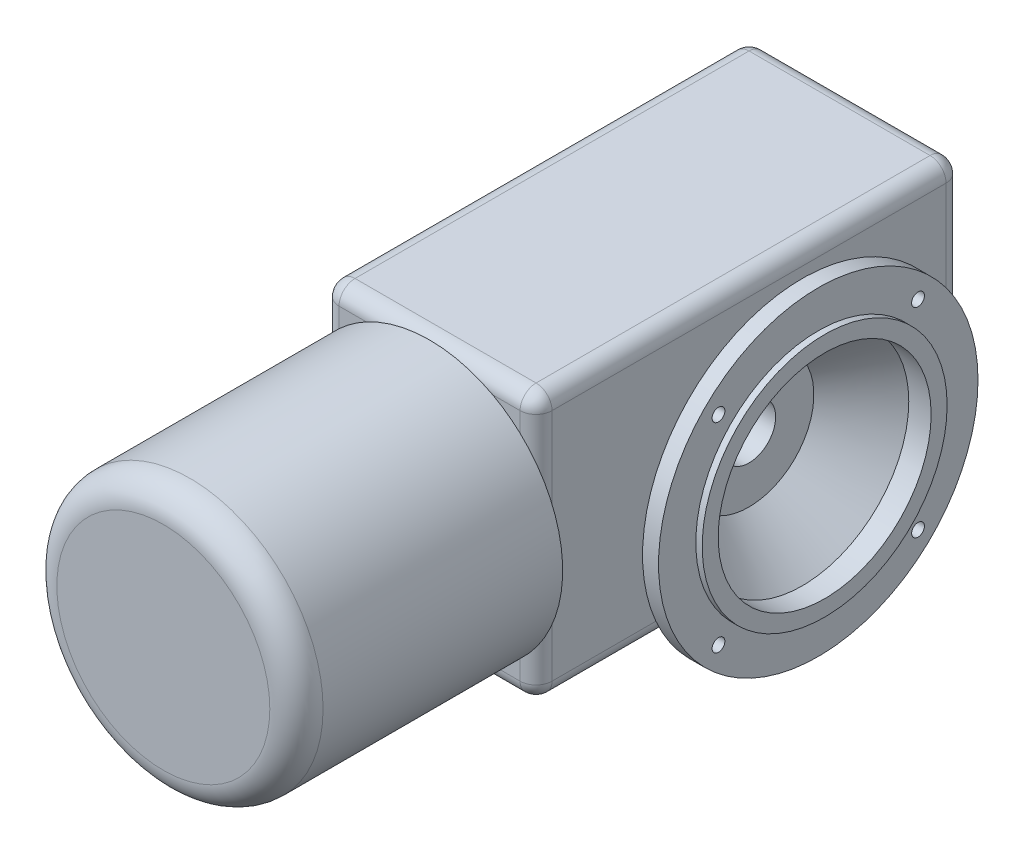
from build123d import *

# Parameters (mm, degrees)
SKETCH_4_W          = 400
SKETCH_4_H          = 250
EXTRUDE_4_DEPTH     = 200
SKETCH_10_R         = 25
CUT_EXTRUDE_1_DEPTH = 180
FILLET_3_R          = 15
SKETCH_9_R          = 125
EXTRUDE_8_DEPTH     = 250
FILLET_4_R          = 25
SKETCH_5_R          = 150
SKETCH_5_R_2        = 100
EXTRUDE_5_DEPTH     = 15
SKETCH_6_R          = 115
SKETCH_6_R_2        = 100
EXTRUDE_6_DEPTH     = 6
SKETCH_13_R         = 6
CUT_EXTRUDE_2_DEPTH = 15


with BuildPart() as part:
    # 草图4 → 凸台-拉伸4 (new body)
    with BuildSketch(Plane(origin=(0, 0, 0), x_dir=(0, 0, -1), z_dir=(1, 0, 0))):
        Rectangle(SKETCH_4_W, SKETCH_4_H)
    extrude(amount=-EXTRUDE_4_DEPTH)

    # 草图10 → 切除-拉伸1 (cut)
    with BuildSketch(Plane(origin=(0, 0, 0), x_dir=(0, 0, -1), z_dir=(1, 0, 0))):
        Circle(SKETCH_10_R)
    extrude(amount=-CUT_EXTRUDE_1_DEPTH, mode=Mode.SUBTRACT)

    # 圆角3
    fillet_3_edges = [part.edges().sort_by_distance(p)[0] for p in [
        (-200, 0, -200),
        (-200, 125, 0),
        (-200, 0, 200),
        (0, 125, 0),
        (0, 0, -200),
        (0, -125, 0),
        (0, 0, 200),
        (-200, -125, 0),
        (-100, 125, 200),
        (-100, 125, -200),
        (-100, -125, -200),
        (-100, -125, 200),
    ]]
    fillet(fillet_3_edges, radius=FILLET_3_R)

    # 草图9 → 凸台-拉伸8 (add)
    with BuildSketch(Plane.XY.offset(200)):
        with Locations(Location((-100, 0, 0), (0, 0, 132.843643044))):
            Circle(SKETCH_9_R)
    extrude(amount=EXTRUDE_8_DEPTH)

    # 圆角4
    fillet_4_edges = [part.edges().sort_by_distance(p)[0] for p in [
        (-14.999999999, -91.651513899, 450),
    ]]
    fillet(fillet_4_edges, radius=FILLET_4_R)

    # 草图12 → 旋转1 (revolve)
    with BuildSketch(Plane.XY, mode=Mode.PRIVATE) as revolve_1_sk:
        Polygon((0, 75), (50, 125), (50, 110.857864376), (0, 60.857864376), align=None)
    revolve(revolve_1_sk.sketch.rotate(Axis((-1000, 0, 0), (1, 0, 0)), 90), axis=Axis((-1000, 0, 0), (1, 0, 0)))

    # 草图5 → 凸台-拉伸5 (add)
    with BuildSketch(Plane(origin=(50, 0, 0), x_dir=(0, 0, -1), z_dir=(1, 0, 0))):
        Circle(SKETCH_5_R)
        Circle(SKETCH_5_R_2, mode=Mode.SUBTRACT)
    extrude(amount=EXTRUDE_5_DEPTH)

    # 草图6 → 凸台-拉伸6 (add)
    with BuildSketch(Plane(origin=(65, 0, 0), x_dir=(0, 0, -1), z_dir=(1, 0, 0))):
        Circle(SKETCH_6_R)
        Circle(SKETCH_6_R_2, mode=Mode.SUBTRACT)
    extrude(amount=EXTRUDE_6_DEPTH)

    # 草图13 → 切除-拉伸2 (cut)
    with BuildSketch(Plane(origin=(65, 0, 0), x_dir=(0, 0, -1), z_dir=(1, 0, 0))):
        with Locations((93.691648507, 93.691648507)):
            Circle(SKETCH_13_R)
        with Locations((-93.691648507, -93.691648507)):
            Circle(SKETCH_13_R)
        with Locations((-93.691648507, 93.691648507)):
            Circle(SKETCH_13_R)
        with Locations((93.691648507, -93.691648507)):
            Circle(SKETCH_13_R)
    extrude(amount=-CUT_EXTRUDE_2_DEPTH, mode=Mode.SUBTRACT)


solid = part.part
